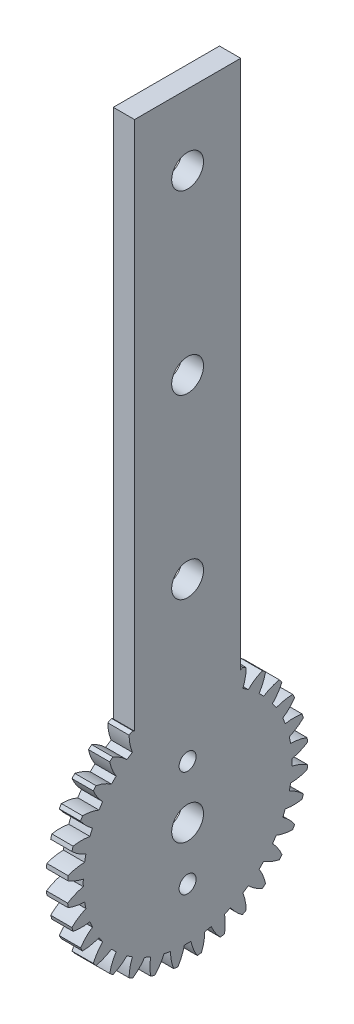
from build123d import *

# Parameters (mm, degrees)
BASPROSKE_W          = 3
BASPROSKE_H          = 17
TOOTHCUT_DEPTH       = 25.228082879
TEETHCUTS_COUNT      = 32
TEETHCUTS_ANGLE      = 348.75
BORSKE_R             = 2
BORE_DEPTH           = 50.0000508
SKETCH1_W            = 15
SKETCH1_H            = 80
BOSS_EXTRUDE1_DEPTH  = 3
M4_CLEARANCE_HOLE1_D = 4.5
M2_CLEARANCE_HOLE1_D = 2.4


with BuildPart() as part:
    # BasProSke → Base-Revolve (revolve)
    with BuildSketch(Plane(origin=(0, 0, 0), x_dir=(1, 0, 0), z_dir=(0, 1, 0)), mode=Mode.PRIVATE) as base_revolve_sk:
        with Locations((1.5, 8.5)):
            Rectangle(BASPROSKE_W, BASPROSKE_H)
    revolve(base_revolve_sk.sketch.rotate(Axis((-10, 0, 0), (1, 0, 0)), 180), axis=Axis((-10, 0, 0), (1, 0, 0)))

    # TooCutSke → ToothCut (cut, through all)
    with BuildSketch(Plane(origin=(0, 0, 0), x_dir=(0, 0, -1), z_dir=(1, 0, 0))):
        with BuildLine():
            ThreePointArc((0.462036907, 14.741761187), (0, 14.749), (-0.462036907, 14.741761187))
            ThreePointArc((-0.462036907, 14.741761187), (-0.81854142, 15.899240468), (-1.386721275, 16.9688317))
            ThreePointArc((-1.386721275, 16.9688317), (0, 17.0254), (1.386721275, 16.9688317))
            ThreePointArc((1.386721275, 16.9688317), (0.81854142, 15.899240468), (0.462036907, 14.741761187))
        make_face()
    toothcut = extrude(amount=TOOTHCUT_DEPTH, mode=Mode.SUBTRACT)

    # TeethCuts: ToothCut ×32 about axis
    teethcuts_axis = Axis((-10, 0, 0), (1, 0, 0))
    for i in range(1, TEETHCUTS_COUNT):
        add(toothcut.rotate(teethcuts_axis, i * TEETHCUTS_ANGLE / (TEETHCUTS_COUNT - 1)), mode=Mode.SUBTRACT)

    # BorSke → Bore (cut, symmetric)
    with BuildSketch(Plane(origin=(0, 0, 0), x_dir=(0, 0, -1), z_dir=(1, 0, 0))):
        with Locations(Location((0, 0, 0), (0, 0, 180))):
            Circle(BORSKE_R)
    extrude(amount=BORE_DEPTH, both=True, mode=Mode.SUBTRACT)

    # Sketch1 → Boss-Extrude1 (add)
    with BuildSketch(Plane(origin=(3, 0, 0), x_dir=(0, 0, -1), z_dir=(1, 0, 0))):
        with Locations((0, 49.788617333)):
            Rectangle(SKETCH1_W, SKETCH1_H)
    extrude(amount=-BOSS_EXTRUDE1_DEPTH)

    # M4 Clearance Hole1 (through all)
    with Locations(Plane(origin=(3, 0, 0), x_dir=(0, 0, -1), z_dir=(1, 0, 0))):
        with Locations((0, 79.788617333), (0, 29.788617333), (0, 54.788617333), (0, 0)):
            Hole(M4_CLEARANCE_HOLE1_D / 2)

    # M2 Clearance Hole1 (through all)
    with Locations(Plane(origin=(3, 0, 0), x_dir=(0, 0, -1), z_dir=(1, 0, 0))):
        with Locations((0, 7.5), (0, -7.5)):
            Hole(M2_CLEARANCE_HOLE1_D / 2)


solid = part.part
